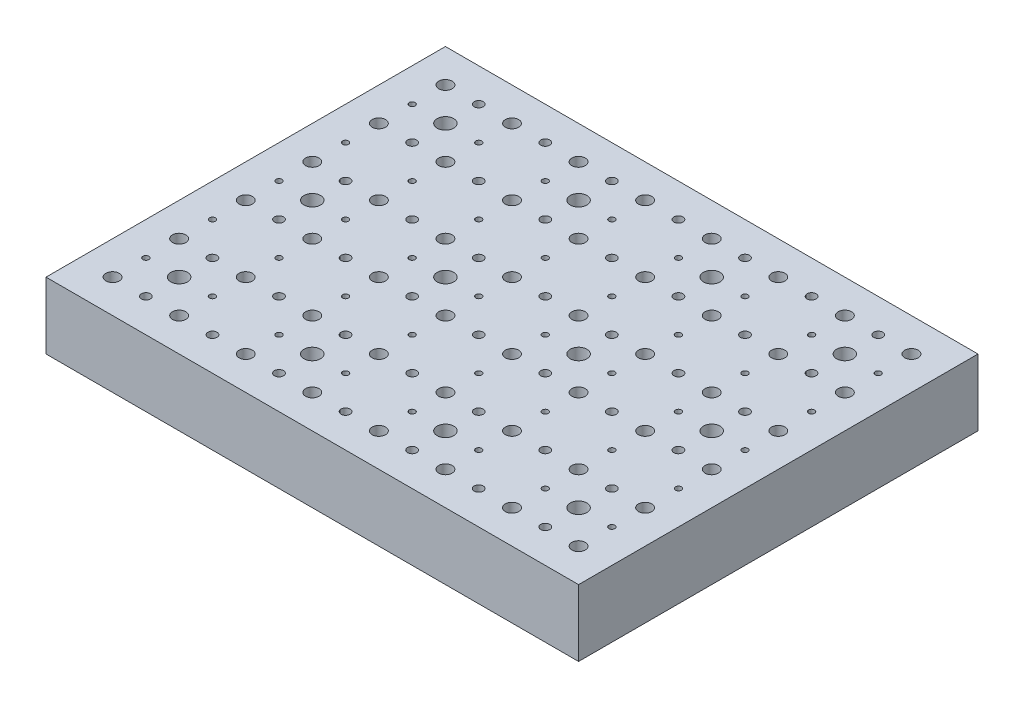
from build123d import *

# Parameters (mm, degrees)
SKETCH1_W                         = 203.2
SKETCH1_H                         = 152.4
BOSS_EXTRUDE1_DEPTH               = 25.4
F_1_4_20_TAPPED_HOLE2_D           = 5.1054
F_8_32_TAPPED_HOLE1_D             = 3.4544
F_4_40_TAPPED_HOLE1_D             = 2.2606
SKETCH9_R                         = 3.175
BUSHINGS_FOR_1_8_DOWEL_PINS_DEPTH = 12.7


with BuildPart() as part:
    # Sketch1 → Boss-Extrude1 (new body)
    with BuildSketch(Plane(origin=(0, 0, 0), x_dir=(1, 0, 0), z_dir=(0, 1, 0))):
        Rectangle(SKETCH1_W, SKETCH1_H)
    extrude(amount=-BOSS_EXTRUDE1_DEPTH)

    # 1/4-20 Tapped Hole2 (through all)
    with Locations(Plane(origin=(0, 0, 0), x_dir=(1, 0, 0), z_dir=(0, 1, 0))):
        with Locations((-88.9, 63.5), (-63.5, 63.5), (-38.1, 63.5), (-12.7, 63.5), (12.7, 63.5), (38.1, 63.5), (63.5, 63.5), (88.9, 63.5), (-63.5, 38.1), (-38.1, 38.1), (-12.7, 38.1), (12.7, 38.1), (38.1, 38.1), (63.5, 38.1), (88.9, 38.1), (-63.5, 12.7), (-38.1, 12.7), (-12.7, 12.7), (12.7, 12.7), (38.1, 12.7), (63.5, 12.7), (88.9, 12.7), (-63.5, -12.7), (-38.1, -12.7), (-12.7, -12.7), (12.7, -12.7), (38.1, -12.7), (63.5, -12.7), (88.9, -12.7), (-63.5, -38.1), (-38.1, -38.1), (-12.7, -38.1), (12.7, -38.1), (38.1, -38.1), (63.5, -38.1), (88.9, -38.1), (-63.5, -63.5), (-38.1, -63.5), (-12.7, -63.5), (12.7, -63.5), (38.1, -63.5), (63.5, -63.5), (88.9, -63.5), (-88.9, 38.1), (-88.9, 12.7), (-88.9, -12.7), (-88.9, -38.1), (-88.9, -63.5)):
            Hole(F_1_4_20_TAPPED_HOLE2_D / 2)

    # #8-32 Tapped Hole1 (through all)
    with Locations(Plane(origin=(0, 0, 0), x_dir=(1, 0, 0), z_dir=(0, 1, 0))):
        with Locations((-76.2, 63.5), (-50.8, 63.5), (-25.4, 63.5), (0, 63.5), (25.4, 63.5), (50.8, 63.5), (76.2, 63.5), (-50.8, 38.1), (-25.4, 38.1), (0, 38.1), (25.4, 38.1), (50.8, 38.1), (76.2, 38.1), (-50.8, 12.7), (-25.4, 12.7), (0, 12.7), (25.4, 12.7), (50.8, 12.7), (76.2, 12.7), (-50.8, -12.7), (-25.4, -12.7), (0, -12.7), (25.4, -12.7), (50.8, -12.7), (76.2, -12.7), (-50.8, -38.1), (-25.4, -38.1), (0, -38.1), (25.4, -38.1), (50.8, -38.1), (76.2, -38.1), (-50.8, -63.5), (-25.4, -63.5), (0, -63.5), (25.4, -63.5), (50.8, -63.5), (76.2, -63.5), (-76.2, 38.1), (-76.2, 12.7), (-76.2, -12.7), (-76.2, -38.1), (-76.2, -63.5)):
            Hole(F_8_32_TAPPED_HOLE1_D / 2)

    # #4-40 Tapped Hole1 (through all)
    with Locations(Plane(origin=(0, 0, 0), x_dir=(1, 0, 0), z_dir=(0, 1, 0))):
        with Locations((-88.9, 50.8), (-63.5, 50.8), (-38.1, 50.8), (-12.7, 50.8), (12.7, 50.8), (38.1, 50.8), (63.5, 50.8), (88.9, 50.8), (-63.5, 25.4), (-38.1, 25.4), (-12.7, 25.4), (12.7, 25.4), (38.1, 25.4), (63.5, 25.4), (88.9, 25.4), (-63.5, 0), (-38.1, 0), (-12.7, 0), (12.7, 0), (38.1, 0), (63.5, 0), (88.9, 0), (-63.5, -25.4), (-38.1, -25.4), (-12.7, -25.4), (12.7, -25.4), (38.1, -25.4), (63.5, -25.4), (88.9, -25.4), (-63.5, -50.8), (-38.1, -50.8), (-12.7, -50.8), (12.7, -50.8), (38.1, -50.8), (63.5, -50.8), (88.9, -50.8), (-88.9, 25.4), (-88.9, 0), (-88.9, -25.4), (-88.9, -50.8)):
            Hole(F_4_40_TAPPED_HOLE1_D / 2)

    # Sketch9 → Bushings for 1/8'' dowel pins (cut)
    with BuildSketch(Plane(origin=(0, 0, 0), x_dir=(1, 0, 0), z_dir=(0, 1, 0))):
        with Locations(Location((-76.2, 50.8, 0), (0, 0, 270))):
            Circle(SKETCH9_R)
        with Locations(Location((-25.4, 50.8, 0), (0, 0, 270))):
            Circle(SKETCH9_R)
        with Locations(Location((25.4, 50.8, 0), (0, 0, 270))):
            Circle(SKETCH9_R)
        with Locations(Location((76.2, 50.8, 0), (0, 0, 270))):
            Circle(SKETCH9_R)
        with Locations(Location((-25.4, 0, 0), (0, 0, 270))):
            Circle(SKETCH9_R)
        with Locations(Location((25.4, 0, 0), (0, 0, 270))):
            Circle(SKETCH9_R)
        with Locations(Location((76.2, 0, 0), (0, 0, 270))):
            Circle(SKETCH9_R)
        with Locations(Location((-25.4, -50.8, 0), (0, 0, 270))):
            Circle(SKETCH9_R)
        with Locations(Location((25.4, -50.8, 0), (0, 0, 270))):
            Circle(SKETCH9_R)
        with Locations(Location((76.2, -50.8, 0), (0, 0, 270))):
            Circle(SKETCH9_R)
        with Locations(Location((-76.2, 0, 0), (0, 0, 270))):
            Circle(SKETCH9_R)
        with Locations(Location((-76.2, -50.8, 0), (0, 0, 270))):
            Circle(SKETCH9_R)
    extrude(amount=-BUSHINGS_FOR_1_8_DOWEL_PINS_DEPTH, mode=Mode.SUBTRACT)


solid = part.part
